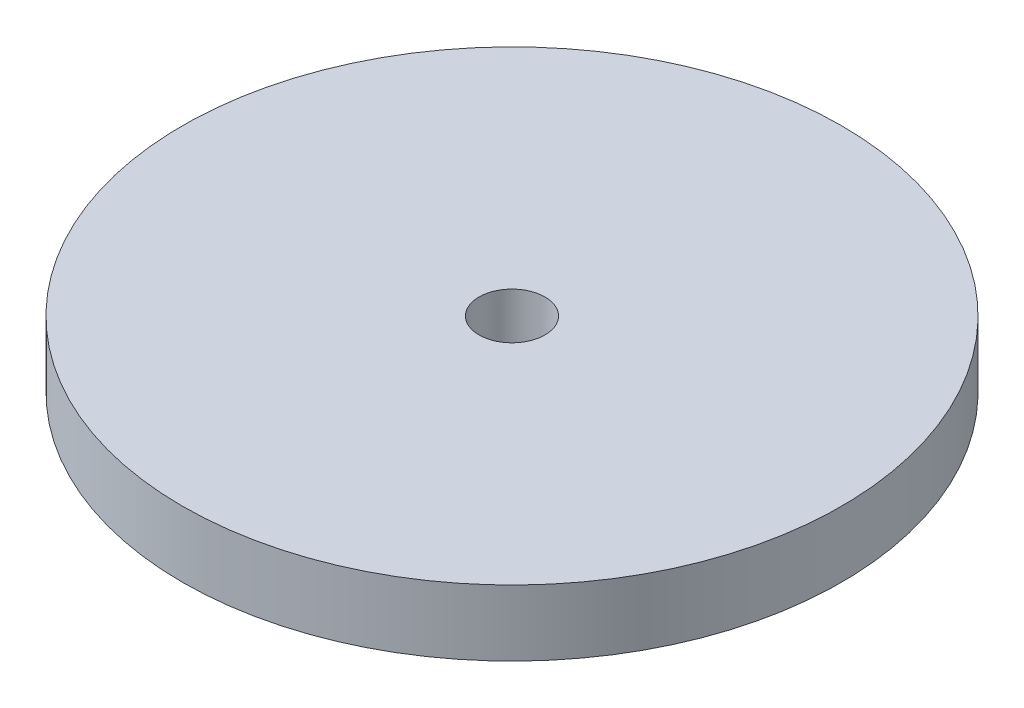
from build123d import *

# Parameters (mm, degrees)
SKETCH_1_R               = 20
EXTRUDE_1_DEPTH          = 4
CUT_EXTRUDE_1_DEPTH      = 29.565713714
CUT_EXTRUDE_1_DEPTH_BACK = 29.565713714
SKETCH_2_R               = 2


with BuildPart() as part:
    # 草图1 → 凸台-拉伸1 (new body)
    with BuildSketch(Plane(origin=(0, 0, 0), x_dir=(1, 0, 0), z_dir=(0, 1, 0))):
        with Locations(Location((0, 0, 0), (0, 0, 270))):
            Circle(SKETCH_1_R)
    extrude(amount=EXTRUDE_1_DEPTH)

    # 草图2 → 切除-拉伸1 (cut, two sides: drawn at the far end of the back side and taken through both)
    with BuildSketch(Plane.XZ.offset(-CUT_EXTRUDE_1_DEPTH_BACK)):
        with Locations(Location((0, 0, 0), (0, 0, 270))):
            Circle(SKETCH_2_R)
    extrude(amount=CUT_EXTRUDE_1_DEPTH + CUT_EXTRUDE_1_DEPTH_BACK, mode=Mode.SUBTRACT)


solid = part.part
